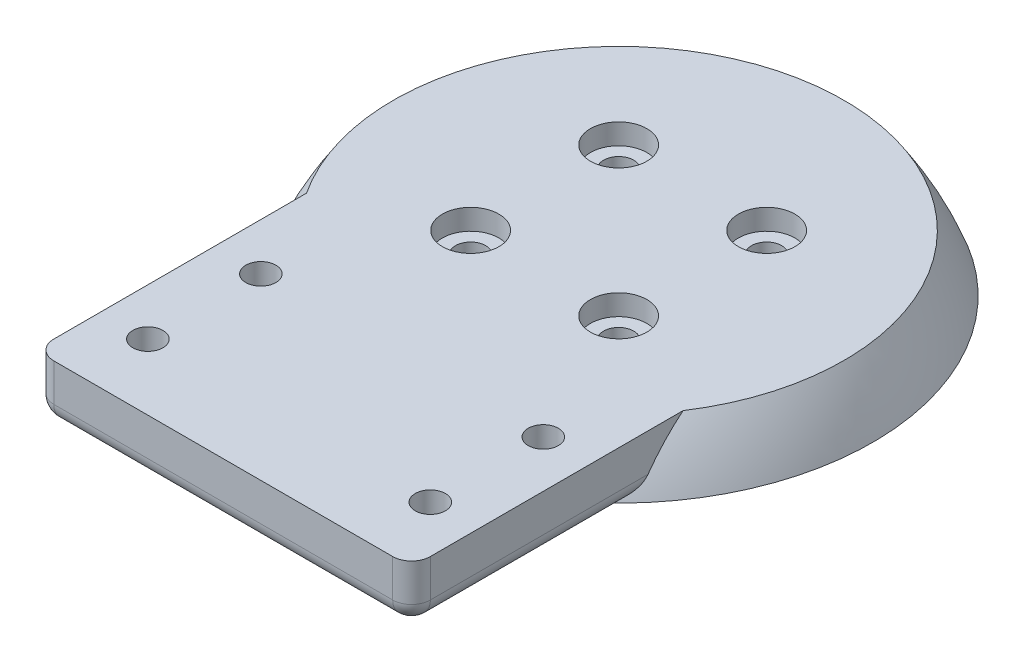
from build123d import *

# Parameters (mm, degrees)
SKETCH_15_W          = 40
SKETCH_15_H          = 18.792360098
EXTRUDE_5_DEPTH      = 42
CUT_EXTRUDE_9_DEPTH  = 77.440518039
CUT_EXTRUDE_10_DEPTH = 51.289163843
SKETCH_18_R          = 3
CUT_EXTRUDE_11_DEPTH = 2.2
SKETCH_19_R          = 1.6
CUT_EXTRUDE_12_DEPTH = 51.289163843
CUT_EXTRUDE_13_DEPTH = 2.2
FILLET_2_R           = 2


with BuildPart() as part:
    # 草图14 → 旋转4 (revolve)
    with BuildSketch(Plane.XY):
        with BuildLine():
            Line((0, 18.792360098), (0, 0))
            Line((0, 0), (27, 0))
            ThreePointArc((27, 0), (16.448045462, 13.631796387), (0, 18.792360098))
        make_face()
    revolve(axis=Axis((0, 18.792360098, 0), (0, -1, 0)))

    # 草图15 → 凸台-拉伸5 (add)
    with BuildSketch(Plane.XY):
        with Locations((0, 9.396180049)):
            Rectangle(SKETCH_15_W, SKETCH_15_H)
    extrude(amount=EXTRUDE_5_DEPTH)

    # 草图16 → 切除-拉伸9 (cut, through all)
    with BuildSketch(Plane.XY.offset(42)):
        Polygon((-20, 6), (0, 6), (20, 6), (20, 18.792360098), (-20, 18.792360098), align=None)
        Polygon((20, 18.792360098), (20, 6), (23.937418407, 6), (23.937418407, 21.459034266), (-28.897937851, 21.459034266), (-28.897937851, 6), (-20, 6), (-20, 18.792360098), align=None)
    extrude(amount=-CUT_EXTRUDE_9_DEPTH, mode=Mode.SUBTRACT)

    # 草图17 → 切除-拉伸10 (cut, through all)
    with BuildSketch(Plane(origin=(0, 6, 0), x_dir=(1, 0, 0), z_dir=(0, 1, 0))):
        with BuildLine():
            Line((-7.86, 6.26), (-7.86, 7.86))
            Line((-7.86, 7.86), (-6.26, 7.86))
            ThreePointArc((-6.26, 7.86), (-8.99137085, 8.99137085), (-7.86, 6.26))
        make_face()
        with BuildLine():
            Line((-6.26, 7.86), (-7.86, 7.86))
            Line((-7.86, 7.86), (-7.86, 6.26))
            ThreePointArc((-7.86, 6.26), (-6.72862915, 6.72862915), (-6.26, 7.86))
        make_face()
        with BuildLine():
            ThreePointArc((9.46, 7.86), (7.86, 9.46), (6.26, 7.86))
            Line((6.26, 7.86), (7.86, 7.86))
            Line((7.86, 7.86), (7.86, 6.26))
            ThreePointArc((7.86, 6.26), (8.99137085, 6.72862915), (9.46, 7.86))
        make_face()
        with BuildLine():
            Line((7.86, 7.86), (6.26, 7.86))
            ThreePointArc((6.26, 7.86), (6.72862915, 6.72862915), (7.86, 6.26))
            Line((7.86, 6.26), (7.86, 7.86))
        make_face()
        with BuildLine():
            ThreePointArc((9.46, -7.86), (8.99137085, -6.72862915), (7.86, -6.26))
            Line((7.86, -6.26), (7.86, -7.86))
            Line((7.86, -7.86), (6.26, -7.86))
            ThreePointArc((6.26, -7.86), (7.86, -9.46), (9.46, -7.86))
        make_face()
        with BuildLine():
            Line((7.86, -7.86), (7.86, -6.26))
            ThreePointArc((7.86, -6.26), (6.72862915, -6.72862915), (6.26, -7.86))
            Line((6.26, -7.86), (7.86, -7.86))
        make_face()
        with BuildLine():
            ThreePointArc((-6.26, -7.86), (-6.72862915, -6.72862915), (-7.86, -6.26))
            Line((-7.86, -6.26), (-7.86, -7.86))
            Line((-7.86, -7.86), (-6.26, -7.86))
        make_face()
        with BuildLine():
            Line((-7.86, -7.86), (-7.86, -6.26))
            ThreePointArc((-7.86, -6.26), (-8.99137085, -8.99137085), (-6.26, -7.86))
            Line((-6.26, -7.86), (-7.86, -7.86))
        make_face()
    extrude(amount=-CUT_EXTRUDE_10_DEPTH, mode=Mode.SUBTRACT)

    # 草图18 → 切除-拉伸11 (cut)
    with BuildSketch(Plane(origin=(0, 6, 0), x_dir=(1, 0, 0), z_dir=(0, 1, 0))):
        with Locations(Location((7.86, 7.86, 0), (0, 0, 180))):
            Circle(SKETCH_18_R)
        with Locations(Location((7.86, -7.86, 0), (0, 0, 180))):
            Circle(SKETCH_18_R)
        with Locations(Location((-7.86, -7.86, 0), (0, 0, 180))):
            Circle(SKETCH_18_R)
        with Locations(Location((-7.86, 7.86, 0), (0, 0, 180))):
            Circle(SKETCH_18_R)
    extrude(amount=-CUT_EXTRUDE_11_DEPTH, mode=Mode.SUBTRACT)

    # 草图19 → 切除-拉伸12 (cut, through all)
    with BuildSketch(Plane(origin=(0, 6, 0), x_dir=(1, 0, 0), z_dir=(0, 1, 0))):
        with Locations(Location((15, -23.002515628, 0), (0, 0, 180))):
            Circle(SKETCH_19_R)
        with Locations(Location((-15, -23.002515628, 0), (0, 0, 180))):
            Circle(SKETCH_19_R)
        with Locations(Location((-15, -35.002515628, 0), (0, 0, 180))):
            Circle(SKETCH_19_R)
        with Locations(Location((15, -35.002515628, 0), (0, 0, 180))):
            Circle(SKETCH_19_R)
    extrude(amount=-CUT_EXTRUDE_12_DEPTH, mode=Mode.SUBTRACT)

    # 草图20 → 切除-拉伸13 (cut)
    with BuildSketch(Plane.XZ):
        Polygon((-15, 31.711619093), (-12.15, 33.35706736), (-12.15, 36.647963895), (-15, 38.293412162), (-17.85, 36.647963895), (-17.85, 33.35706736), align=None)
        Polygon((15, 31.711619093), (17.85, 33.35706736), (17.85, 36.647963895), (15, 38.293412162), (12.15, 36.647963895), (12.15, 33.35706736), align=None)
        Polygon((-15, 19.711619093), (-12.15, 21.35706736), (-12.15, 24.647963895), (-15, 26.293412162), (-17.85, 24.647963895), (-17.85, 21.35706736), align=None)
        Polygon((15, 19.711619093), (17.85, 21.35706736), (17.85, 24.647963895), (15, 26.293412162), (12.15, 24.647963895), (12.15, 21.35706736), align=None)
    extrude(amount=-CUT_EXTRUDE_13_DEPTH, mode=Mode.SUBTRACT)

    # 圆角2
    fillet_2_edges = [part.edges().sort_by_distance(p)[0] for p in [
        (20, 0, 30.069178574),
        (-20, 0, 30.069178574),
        (0, 0, 42),
        (-20, 3, 42),
        (20, 3, 42),
    ]]
    fillet(fillet_2_edges, radius=FILLET_2_R)


solid = part.part
